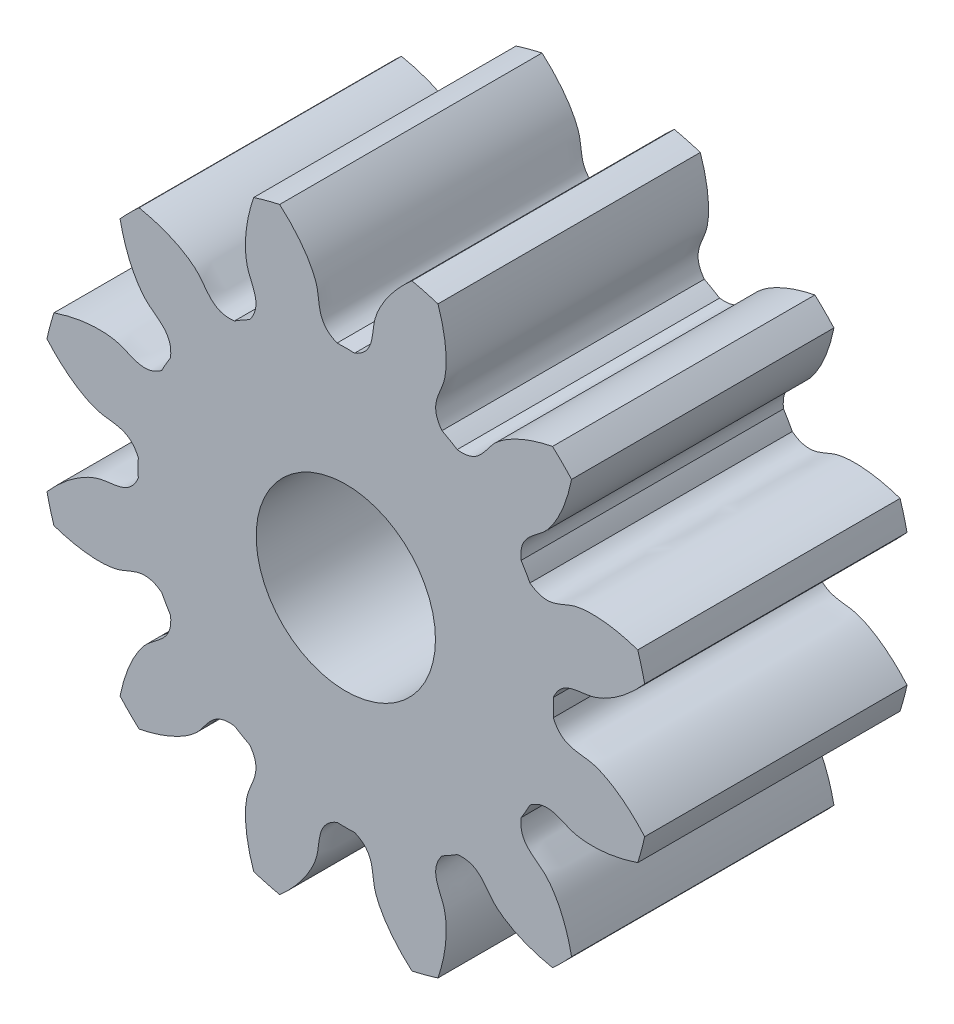
from build123d import *

# Parameters (mm, degrees)
SKETCH_1_R               = 3.5
EXTRUDE_1_DEPTH          = 3
CUT_EXTRUDE_1_DEPTH      = 6.787918451
PATTERN_CIRCULAR_1_COUNT = 12
CUT_EXTRUDE_2_REACH      = 7.688
SKETCH_5_R               = 1.025


with BuildPart() as part:
    # 草图1 → 凸台-拉伸1 (new body)
    with BuildSketch(Plane.XY):
        Circle(SKETCH_1_R)
    extrude(amount=EXTRUDE_1_DEPTH)

    # 草图2 → 切除-拉伸1 (cut, through all)
    with BuildSketch(Plane.XY):
        with BuildLine():
            ThreePointArc((0.100420056, 2.372876063), (0, 2.375), (-0.100420056, 2.372876063))
            add(Edge.make_bspline(
                [(-0.100420056, 2.372876063), (-0.340394435, 2.474653731), (-0.287186739, 2.672409341), (-0.338076094, 2.844740289), (-0.341311927, 2.854952869), (-0.345113625, 2.866166713), (-0.349521434, 2.878363044), (-0.354576313, 2.891521619), (-0.360318258, 2.905621034), (-0.36678678, 2.920638648), (-0.374020716, 2.936550626), (-0.382058239, 2.95333195), (-0.390936819, 2.970956436), (-0.400693193, 2.989396753), (-0.411363332, 3.008624444), (-0.422982412, 3.02860994), (-0.435584786, 3.049322589), (-0.449203949, 3.07073067), (-0.463872517, 3.092801417), (-0.479622192, 3.115501045), (-0.496483738, 3.138794769), (-0.514486952, 3.162646832), (-0.533660639, 3.187020528), (-0.554032585, 3.211878226), (-0.575629533, 3.237181399), (-0.598477155, 3.262890651), (-0.622600033, 3.288965742), (-0.648021632, 3.315365616), (-0.674764279, 3.342048434), (-0.702849139, 3.368971597), (-0.732296196, 3.396091781), (-0.763124233, 3.423364967), (-0.795350811, 3.450746465), (-0.828992247, 3.478190957), (-0.864063604, 3.505652518), (-0.900578664, 3.533084654), (-0.938549918, 3.560440334), (-0.977988547, 3.587672024), (-1.01890441, 3.614731718), (-1.061306025, 3.641570973), (-1.10520056, 3.668140947), (-1.150593819, 3.694392428), (-1.197490231, 3.720275872), (-1.245892835, 3.74574144), (-1.295803277, 3.770739031), (-1.347221796, 3.79521832), (-1.400147219, 3.819128792), (-1.454576948, 3.842419781), (-1.510506963, 3.865040505), (-1.567931802, 3.886940103), (-1.647189853, 3.915363979), (-1.7077968, 3.935050704), (-1.748802701, 3.947485455)],
                knots=[0, 0, 0, 0, 0.218015236, 0.222043642, 0.226545979, 0.231522246, 0.236972443, 0.24289657, 0.249294627, 0.256166614, 0.263512532, 0.271332379, 0.279626157, 0.288393865, 0.297635503, 0.307351072, 0.31754057, 0.328203999, 0.339341357, 0.350952646, 0.363037866, 0.375597015, 0.388630094, 0.402137104, 0.416118043, 0.430572913, 0.445501713, 0.460904444, 0.476781104, 0.493131694, 0.509956215, 0.527254666, 0.545027047, 0.563273358, 0.581993599, 0.601187771, 0.620855872, 0.640997904, 0.661613866, 0.682703758, 0.704267581, 0.726305333, 0.748817015, 0.771802628, 0.795262171, 0.819195644, 0.843603047, 0.868484381, 0.893839644, 0.919668838, 0.945971962, 1, 1, 1, 1], degree=3))
            ThreePointArc((-1.748802701, 3.947485455), (0, 4.317516914), (1.748802701, 3.947485455))
            add(Edge.make_bspline(
                [(0.100420056, 2.372876063), (0.340394435, 2.474653731), (0.287186739, 2.672409341), (0.338076094, 2.844740289), (0.341311927, 2.854952869), (0.345113625, 2.866166713), (0.349521434, 2.878363044), (0.354576313, 2.891521619), (0.360318258, 2.905621034), (0.36678678, 2.920638648), (0.374020716, 2.936550626), (0.382058239, 2.95333195), (0.390936819, 2.970956436), (0.400693193, 2.989396753), (0.411363332, 3.008624444), (0.422982412, 3.02860994), (0.435584786, 3.049322589), (0.449203949, 3.07073067), (0.463872517, 3.092801417), (0.479622192, 3.115501045), (0.496483738, 3.138794769), (0.514486952, 3.162646832), (0.533660639, 3.187020528), (0.554032585, 3.211878226), (0.575629533, 3.237181399), (0.598477155, 3.262890651), (0.622600033, 3.288965742), (0.648021632, 3.315365616), (0.674764279, 3.342048434), (0.702849139, 3.368971597), (0.732296196, 3.396091781), (0.763124233, 3.423364967), (0.795350811, 3.450746465), (0.828992247, 3.478190957), (0.864063604, 3.505652518), (0.900578664, 3.533084654), (0.938549918, 3.560440334), (0.977988547, 3.587672024), (1.01890441, 3.614731718), (1.061306025, 3.641570973), (1.10520056, 3.668140947), (1.150593819, 3.694392428), (1.197490231, 3.720275872), (1.245892835, 3.74574144), (1.295803277, 3.770739031), (1.347221796, 3.79521832), (1.400147219, 3.819128792), (1.454576948, 3.842419781), (1.510506963, 3.865040505), (1.567931802, 3.886940103), (1.647189853, 3.915363979), (1.7077968, 3.935050704), (1.748802701, 3.947485455)],
                knots=[0, 0, 0, 0, 0.218015236, 0.222043642, 0.226545979, 0.231522246, 0.236972443, 0.24289657, 0.249294627, 0.256166614, 0.263512532, 0.271332379, 0.279626157, 0.288393865, 0.297635503, 0.307351072, 0.31754057, 0.328203999, 0.339341357, 0.350952646, 0.363037866, 0.375597015, 0.388630094, 0.402137104, 0.416118043, 0.430572913, 0.445501713, 0.460904444, 0.476781104, 0.493131694, 0.509956215, 0.527254666, 0.545027047, 0.563273358, 0.581993599, 0.601187771, 0.620855872, 0.640997904, 0.661613866, 0.682703758, 0.704267581, 0.726305333, 0.748817015, 0.771802628, 0.795262171, 0.819195644, 0.843603047, 0.868484381, 0.893839644, 0.919668838, 0.945971962, 1, 1, 1, 1], degree=3))
        make_face()
    cut_extrude_1 = extrude(amount=CUT_EXTRUDE_1_DEPTH, mode=Mode.SUBTRACT)

    # 阵列(圆周)1: 切除-拉伸1 ×12 about axis
    pattern_circular_1_axis = Axis((0, 0, 3), (0, 0, -1))
    for i in range(1, PATTERN_CIRCULAR_1_COUNT):
        add(cut_extrude_1.rotate(pattern_circular_1_axis, i * 360 / PATTERN_CIRCULAR_1_COUNT), mode=Mode.SUBTRACT)

    # 草图5 → 切除-拉伸2 (cut, up to next)
    with BuildSketch(Plane.XY.offset(3), mode=Mode.PRIVATE) as cut_extrude_2_sk1:
        Circle(SKETCH_5_R)
    cut_extrude_2_tool1 = extrude(cut_extrude_2_sk1.sketch, amount=-CUT_EXTRUDE_2_REACH, mode=Mode.PRIVATE) & part.part
    add(cut_extrude_2_tool1.solids().sort_by_distance((0, 0, 3))[0], mode=Mode.SUBTRACT)


solid = part.part
